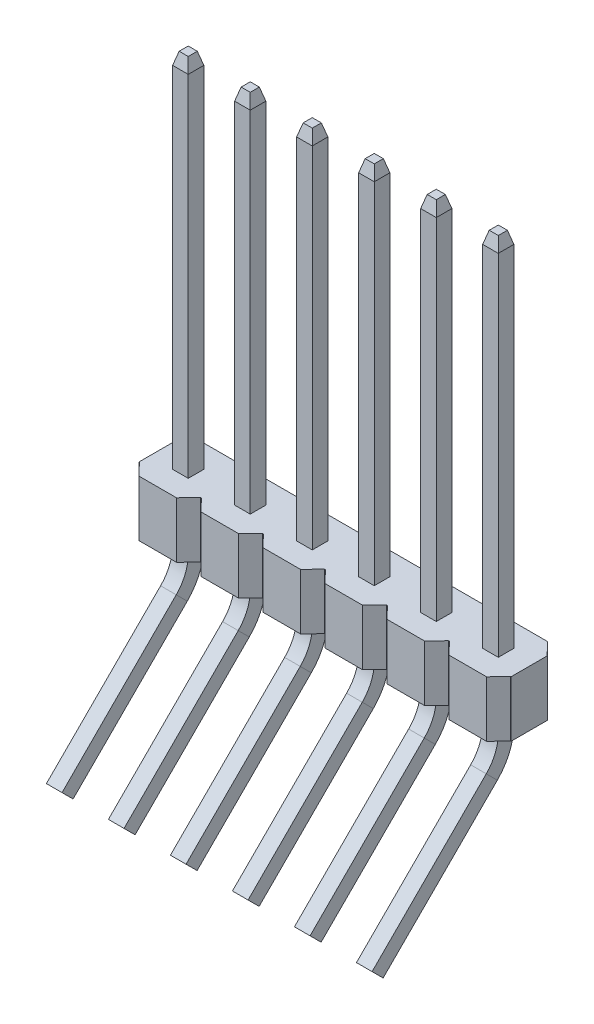
from build123d import *
from OCP.BRepFilletAPI import BRepFilletAPI_MakeChamfer

# Parameters (mm, degrees)
BOSS_EXTRUDE1_DEPTH         = 2.29
SKETCH3_W                   = 0.64
SKETCH3_H                   = 0.64
CHAMFER3_SIZE               = 0.5
CHAMFER3_SIZE2              = 0.133974596
LPATTERN1_COUNT             = 6
LPATTERN1_PITCH             = 2.54
CHAMFER3_OF_LPATTERN1_SIZE  = 0.5
CHAMFER3_OF_LPATTERN1_SIZE2 = 0.133974596


with BuildPart() as part:
    # Sketch1 → Boss-Extrude1 (new body)
    with BuildSketch(Plane(origin=(0, 0, 0), x_dir=(1, 0, 0), z_dir=(0, 1, 0))):
        Polygon((-0.77, 1.25), (0.77, 1.25), (1.25, 0.75), (1.27, 0.75), (1.27, -0.75), (1.25, -0.75), (0.77, -1.25), (-0.77, -1.25), (-1.25, -0.75), (-1.27, -0.75), (-1.27, 0.75), (-1.25, 0.75), align=None)
    boss_extrude1 = extrude(amount=BOSS_EXTRUDE1_DEPTH)

    # Sweep1: sweep along a path in Sketch2
    with BuildLine(Plane(origin=(0, 0, 0), x_dir=(0, 0, -1), z_dir=(1, 0, 0))) as sweep1_path:
        Line((0, 17.12), (0, -0.408142235))
        ThreePointArc((0, -0.408142235), (-0.152240935, -1.1735091), (-0.585786438, -1.822355798))
        Line((-0.585786438, -1.822355798), (-5.26343064, -6.5))
    # Sketch3 → Sweep1 (sweep)
    with BuildSketch(Plane(origin=(0, 17.12, 0), x_dir=(1, 0, 0), z_dir=(0, 1, 0))):
        Rectangle(SKETCH3_W, SKETCH3_H)
    sweep1 = sweep(path=sweep1_path.line)

    # Chamfer3: one chamfer whose edges measure the first distance from different faces: ONE call of the kernel's chamfer builder (chamfer() names one face for all edges)
    chamfer3_edges_1 = [part.edges().sort_by_distance(p)[0] for p in [
        (0.32, 17.12, 0),
    ]]
    chamfer3_side_1 = [part.faces().sort_by_distance(p)[0] for p in [
        (0.32, 9.705, 0),
    ]]
    chamfer3_edges_2 = [part.edges().sort_by_distance(p)[0] for p in [
        (0, 17.12, -0.32),
    ]]
    chamfer3_side_2 = [part.faces().sort_by_distance(p)[0] for p in [
        (0, 9.705, -0.32),
    ]]
    chamfer3_edges_3 = [part.edges().sort_by_distance(p)[0] for p in [
        (-0.32, 17.12, 0),
    ]]
    chamfer3_side_3 = [part.faces().sort_by_distance(p)[0] for p in [
        (-0.32, 9.705, 0),
    ]]
    chamfer3_edges_4 = [part.edges().sort_by_distance(p)[0] for p in [
        (0, 17.12, 0.32),
    ]]
    chamfer3_side_4 = [part.faces().sort_by_distance(p)[0] for p in [
        (0, 9.705, 0.32),
    ]]
    chamfer3 = BRepFilletAPI_MakeChamfer(part.part.solid().wrapped)
    for e in chamfer3_edges_1:
        chamfer3.Add(CHAMFER3_SIZE, CHAMFER3_SIZE2, e.wrapped, chamfer3_side_1[0].wrapped)  # the first distance lies on this face
    for e in chamfer3_edges_2:
        chamfer3.Add(CHAMFER3_SIZE, CHAMFER3_SIZE2, e.wrapped, chamfer3_side_2[0].wrapped)  # the first distance lies on this face
    for e in chamfer3_edges_3:
        chamfer3.Add(CHAMFER3_SIZE, CHAMFER3_SIZE2, e.wrapped, chamfer3_side_3[0].wrapped)  # the first distance lies on this face
    for e in chamfer3_edges_4:
        chamfer3.Add(CHAMFER3_SIZE, CHAMFER3_SIZE2, e.wrapped, chamfer3_side_4[0].wrapped)  # the first distance lies on this face
    add(Compound.cast(chamfer3.Shape()), mode=Mode.REPLACE)

    # LPattern1: Boss-Extrude1, Sweep1 ×6
    with Locations(*[(i * LPATTERN1_PITCH, 0, 0) for i in range(1, LPATTERN1_COUNT)]):
        add(boss_extrude1)
        add(sweep1)

    # Chamfer3 of LPattern1: one chamfer whose edges measure the first distance from different faces: ONE call of the kernel's chamfer builder (chamfer() names one face for all edges)
    chamfer3_of_lpattern1_edges_1 = [part.edges().sort_by_distance(p)[0] for p in [
        (2.86, 17.12, 0),
    ]]
    chamfer3_of_lpattern1_side_1 = [part.faces().sort_by_distance(p)[0] for p in [
        (2.86, 9.705, 0),
    ]]
    chamfer3_of_lpattern1_edges_2 = [part.edges().sort_by_distance(p)[0] for p in [
        (2.54, 17.12, -0.32),
    ]]
    chamfer3_of_lpattern1_side_2 = [part.faces().sort_by_distance(p)[0] for p in [
        (2.54, 9.705, -0.32),
    ]]
    chamfer3_of_lpattern1_edges_3 = [part.edges().sort_by_distance(p)[0] for p in [
        (2.22, 17.12, 0),
    ]]
    chamfer3_of_lpattern1_side_3 = [part.faces().sort_by_distance(p)[0] for p in [
        (2.22, 9.705, 0),
    ]]
    chamfer3_of_lpattern1_edges_4 = [part.edges().sort_by_distance(p)[0] for p in [
        (2.54, 17.12, 0.32),
    ]]
    chamfer3_of_lpattern1_side_4 = [part.faces().sort_by_distance(p)[0] for p in [
        (2.54, 9.705, 0.32),
    ]]
    chamfer3_of_lpattern1_edges_5 = [part.edges().sort_by_distance(p)[0] for p in [
        (5.4, 17.12, 0),
    ]]
    chamfer3_of_lpattern1_side_5 = [part.faces().sort_by_distance(p)[0] for p in [
        (5.4, 9.705, 0),
    ]]
    chamfer3_of_lpattern1_edges_6 = [part.edges().sort_by_distance(p)[0] for p in [
        (5.08, 17.12, -0.32),
    ]]
    chamfer3_of_lpattern1_side_6 = [part.faces().sort_by_distance(p)[0] for p in [
        (5.08, 9.705, -0.32),
    ]]
    chamfer3_of_lpattern1_edges_7 = [part.edges().sort_by_distance(p)[0] for p in [
        (4.76, 17.12, 0),
    ]]
    chamfer3_of_lpattern1_side_7 = [part.faces().sort_by_distance(p)[0] for p in [
        (4.76, 9.705, 0),
    ]]
    chamfer3_of_lpattern1_edges_8 = [part.edges().sort_by_distance(p)[0] for p in [
        (5.08, 17.12, 0.32),
    ]]
    chamfer3_of_lpattern1_side_8 = [part.faces().sort_by_distance(p)[0] for p in [
        (5.08, 9.705, 0.32),
    ]]
    chamfer3_of_lpattern1_edges_9 = [part.edges().sort_by_distance(p)[0] for p in [
        (7.94, 17.12, 0),
    ]]
    chamfer3_of_lpattern1_side_9 = [part.faces().sort_by_distance(p)[0] for p in [
        (7.94, 9.705, 0),
    ]]
    chamfer3_of_lpattern1_edges_10 = [part.edges().sort_by_distance(p)[0] for p in [
        (7.62, 17.12, -0.32),
    ]]
    chamfer3_of_lpattern1_side_10 = [part.faces().sort_by_distance(p)[0] for p in [
        (7.62, 9.705, -0.32),
    ]]
    chamfer3_of_lpattern1_edges_11 = [part.edges().sort_by_distance(p)[0] for p in [
        (7.3, 17.12, 0),
    ]]
    chamfer3_of_lpattern1_side_11 = [part.faces().sort_by_distance(p)[0] for p in [
        (7.3, 9.705, 0),
    ]]
    chamfer3_of_lpattern1_edges_12 = [part.edges().sort_by_distance(p)[0] for p in [
        (7.62, 17.12, 0.32),
    ]]
    chamfer3_of_lpattern1_side_12 = [part.faces().sort_by_distance(p)[0] for p in [
        (7.62, 9.705, 0.32),
    ]]
    chamfer3_of_lpattern1_edges_13 = [part.edges().sort_by_distance(p)[0] for p in [
        (10.48, 17.12, 0),
    ]]
    chamfer3_of_lpattern1_side_13 = [part.faces().sort_by_distance(p)[0] for p in [
        (10.48, 9.705, 0),
    ]]
    chamfer3_of_lpattern1_edges_14 = [part.edges().sort_by_distance(p)[0] for p in [
        (10.16, 17.12, -0.32),
    ]]
    chamfer3_of_lpattern1_side_14 = [part.faces().sort_by_distance(p)[0] for p in [
        (10.16, 9.705, -0.32),
    ]]
    chamfer3_of_lpattern1_edges_15 = [part.edges().sort_by_distance(p)[0] for p in [
        (9.84, 17.12, 0),
    ]]
    chamfer3_of_lpattern1_side_15 = [part.faces().sort_by_distance(p)[0] for p in [
        (9.84, 9.705, 0),
    ]]
    chamfer3_of_lpattern1_edges_16 = [part.edges().sort_by_distance(p)[0] for p in [
        (10.16, 17.12, 0.32),
    ]]
    chamfer3_of_lpattern1_side_16 = [part.faces().sort_by_distance(p)[0] for p in [
        (10.16, 9.705, 0.32),
    ]]
    chamfer3_of_lpattern1_edges_17 = [part.edges().sort_by_distance(p)[0] for p in [
        (13.02, 17.12, 0),
    ]]
    chamfer3_of_lpattern1_side_17 = [part.faces().sort_by_distance(p)[0] for p in [
        (13.02, 9.705, 0),
    ]]
    chamfer3_of_lpattern1_edges_18 = [part.edges().sort_by_distance(p)[0] for p in [
        (12.7, 17.12, -0.32),
    ]]
    chamfer3_of_lpattern1_side_18 = [part.faces().sort_by_distance(p)[0] for p in [
        (12.7, 9.705, -0.32),
    ]]
    chamfer3_of_lpattern1_edges_19 = [part.edges().sort_by_distance(p)[0] for p in [
        (12.38, 17.12, 0),
    ]]
    chamfer3_of_lpattern1_side_19 = [part.faces().sort_by_distance(p)[0] for p in [
        (12.38, 9.705, 0),
    ]]
    chamfer3_of_lpattern1_edges_20 = [part.edges().sort_by_distance(p)[0] for p in [
        (12.7, 17.12, 0.32),
    ]]
    chamfer3_of_lpattern1_side_20 = [part.faces().sort_by_distance(p)[0] for p in [
        (12.7, 9.705, 0.32),
    ]]
    chamfer3_of_lpattern1 = BRepFilletAPI_MakeChamfer(part.part.solid().wrapped)
    for e in chamfer3_of_lpattern1_edges_1:
        chamfer3_of_lpattern1.Add(CHAMFER3_OF_LPATTERN1_SIZE, CHAMFER3_OF_LPATTERN1_SIZE2, e.wrapped, chamfer3_of_lpattern1_side_1[0].wrapped)  # the first distance lies on this face
    for e in chamfer3_of_lpattern1_edges_2:
        chamfer3_of_lpattern1.Add(CHAMFER3_OF_LPATTERN1_SIZE, CHAMFER3_OF_LPATTERN1_SIZE2, e.wrapped, chamfer3_of_lpattern1_side_2[0].wrapped)  # the first distance lies on this face
    for e in chamfer3_of_lpattern1_edges_3:
        chamfer3_of_lpattern1.Add(CHAMFER3_OF_LPATTERN1_SIZE, CHAMFER3_OF_LPATTERN1_SIZE2, e.wrapped, chamfer3_of_lpattern1_side_3[0].wrapped)  # the first distance lies on this face
    for e in chamfer3_of_lpattern1_edges_4:
        chamfer3_of_lpattern1.Add(CHAMFER3_OF_LPATTERN1_SIZE, CHAMFER3_OF_LPATTERN1_SIZE2, e.wrapped, chamfer3_of_lpattern1_side_4[0].wrapped)  # the first distance lies on this face
    for e in chamfer3_of_lpattern1_edges_5:
        chamfer3_of_lpattern1.Add(CHAMFER3_OF_LPATTERN1_SIZE, CHAMFER3_OF_LPATTERN1_SIZE2, e.wrapped, chamfer3_of_lpattern1_side_5[0].wrapped)  # the first distance lies on this face
    for e in chamfer3_of_lpattern1_edges_6:
        chamfer3_of_lpattern1.Add(CHAMFER3_OF_LPATTERN1_SIZE, CHAMFER3_OF_LPATTERN1_SIZE2, e.wrapped, chamfer3_of_lpattern1_side_6[0].wrapped)  # the first distance lies on this face
    for e in chamfer3_of_lpattern1_edges_7:
        chamfer3_of_lpattern1.Add(CHAMFER3_OF_LPATTERN1_SIZE, CHAMFER3_OF_LPATTERN1_SIZE2, e.wrapped, chamfer3_of_lpattern1_side_7[0].wrapped)  # the first distance lies on this face
    for e in chamfer3_of_lpattern1_edges_8:
        chamfer3_of_lpattern1.Add(CHAMFER3_OF_LPATTERN1_SIZE, CHAMFER3_OF_LPATTERN1_SIZE2, e.wrapped, chamfer3_of_lpattern1_side_8[0].wrapped)  # the first distance lies on this face
    for e in chamfer3_of_lpattern1_edges_9:
        chamfer3_of_lpattern1.Add(CHAMFER3_OF_LPATTERN1_SIZE, CHAMFER3_OF_LPATTERN1_SIZE2, e.wrapped, chamfer3_of_lpattern1_side_9[0].wrapped)  # the first distance lies on this face
    for e in chamfer3_of_lpattern1_edges_10:
        chamfer3_of_lpattern1.Add(CHAMFER3_OF_LPATTERN1_SIZE, CHAMFER3_OF_LPATTERN1_SIZE2, e.wrapped, chamfer3_of_lpattern1_side_10[0].wrapped)  # the first distance lies on this face
    for e in chamfer3_of_lpattern1_edges_11:
        chamfer3_of_lpattern1.Add(CHAMFER3_OF_LPATTERN1_SIZE, CHAMFER3_OF_LPATTERN1_SIZE2, e.wrapped, chamfer3_of_lpattern1_side_11[0].wrapped)  # the first distance lies on this face
    for e in chamfer3_of_lpattern1_edges_12:
        chamfer3_of_lpattern1.Add(CHAMFER3_OF_LPATTERN1_SIZE, CHAMFER3_OF_LPATTERN1_SIZE2, e.wrapped, chamfer3_of_lpattern1_side_12[0].wrapped)  # the first distance lies on this face
    for e in chamfer3_of_lpattern1_edges_13:
        chamfer3_of_lpattern1.Add(CHAMFER3_OF_LPATTERN1_SIZE, CHAMFER3_OF_LPATTERN1_SIZE2, e.wrapped, chamfer3_of_lpattern1_side_13[0].wrapped)  # the first distance lies on this face
    for e in chamfer3_of_lpattern1_edges_14:
        chamfer3_of_lpattern1.Add(CHAMFER3_OF_LPATTERN1_SIZE, CHAMFER3_OF_LPATTERN1_SIZE2, e.wrapped, chamfer3_of_lpattern1_side_14[0].wrapped)  # the first distance lies on this face
    for e in chamfer3_of_lpattern1_edges_15:
        chamfer3_of_lpattern1.Add(CHAMFER3_OF_LPATTERN1_SIZE, CHAMFER3_OF_LPATTERN1_SIZE2, e.wrapped, chamfer3_of_lpattern1_side_15[0].wrapped)  # the first distance lies on this face
    for e in chamfer3_of_lpattern1_edges_16:
        chamfer3_of_lpattern1.Add(CHAMFER3_OF_LPATTERN1_SIZE, CHAMFER3_OF_LPATTERN1_SIZE2, e.wrapped, chamfer3_of_lpattern1_side_16[0].wrapped)  # the first distance lies on this face
    for e in chamfer3_of_lpattern1_edges_17:
        chamfer3_of_lpattern1.Add(CHAMFER3_OF_LPATTERN1_SIZE, CHAMFER3_OF_LPATTERN1_SIZE2, e.wrapped, chamfer3_of_lpattern1_side_17[0].wrapped)  # the first distance lies on this face
    for e in chamfer3_of_lpattern1_edges_18:
        chamfer3_of_lpattern1.Add(CHAMFER3_OF_LPATTERN1_SIZE, CHAMFER3_OF_LPATTERN1_SIZE2, e.wrapped, chamfer3_of_lpattern1_side_18[0].wrapped)  # the first distance lies on this face
    for e in chamfer3_of_lpattern1_edges_19:
        chamfer3_of_lpattern1.Add(CHAMFER3_OF_LPATTERN1_SIZE, CHAMFER3_OF_LPATTERN1_SIZE2, e.wrapped, chamfer3_of_lpattern1_side_19[0].wrapped)  # the first distance lies on this face
    for e in chamfer3_of_lpattern1_edges_20:
        chamfer3_of_lpattern1.Add(CHAMFER3_OF_LPATTERN1_SIZE, CHAMFER3_OF_LPATTERN1_SIZE2, e.wrapped, chamfer3_of_lpattern1_side_20[0].wrapped)  # the first distance lies on this face
    add(Compound.cast(chamfer3_of_lpattern1.Shape()), mode=Mode.REPLACE)


solid = part.part
